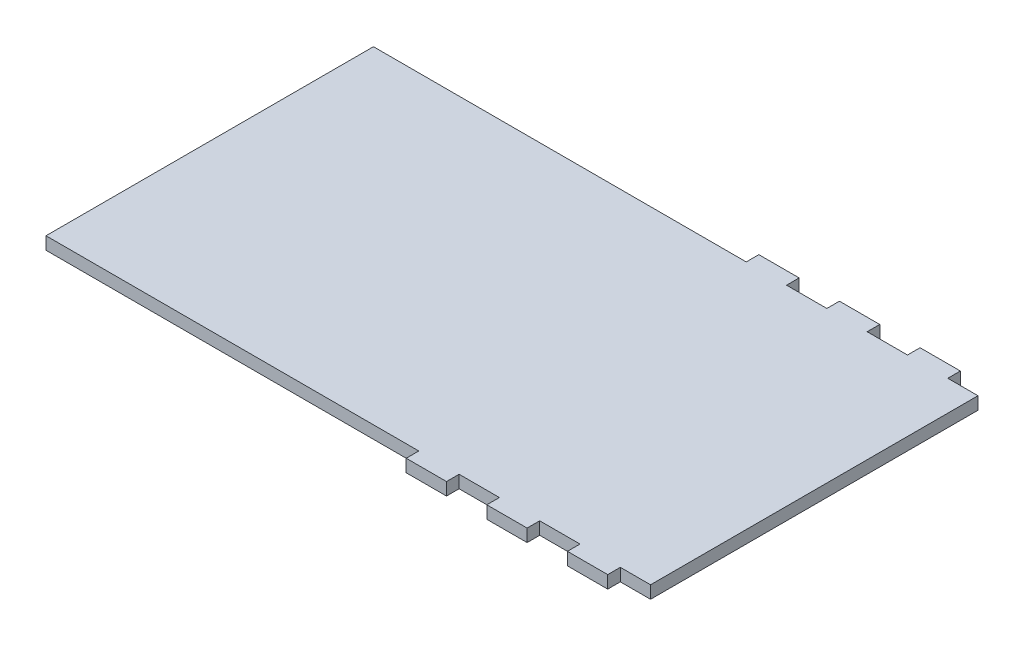
from build123d import *

# Parameters (mm, degrees)
BOSS_EXTRUDE1_DEPTH = 3.175


with BuildPart() as part:
    # Sketch1 → Boss-Extrude1 (new body)
    with BuildSketch(Plane(origin=(0, 0, 0), x_dir=(1, 0, 0), z_dir=(0, 1, 0))):
        Polygon((27.94, -41.275), (38.1, -41.275), (38.1, -44.45), (48.26, -44.45), (48.26, -41.275), (58.42, -41.275), (58.42, -44.45), (68.58, -44.45), (68.58, -41.275), (76.2, -41.275), (76.2, 41.275), (68.58, 41.275), (68.58, 44.45), (58.42, 44.45), (58.42, 41.275), (48.26, 41.275), (48.26, 44.45), (38.1, 44.45), (38.1, 41.275), (27.94, 41.275), (27.94, 44.45), (17.78, 44.45), (17.78, 41.275), (-76.2, 41.275), (-76.2, -41.275), (17.78, -41.275), (17.78, -44.45), (27.94, -44.45), align=None)
    extrude(amount=BOSS_EXTRUDE1_DEPTH)


solid = part.part
